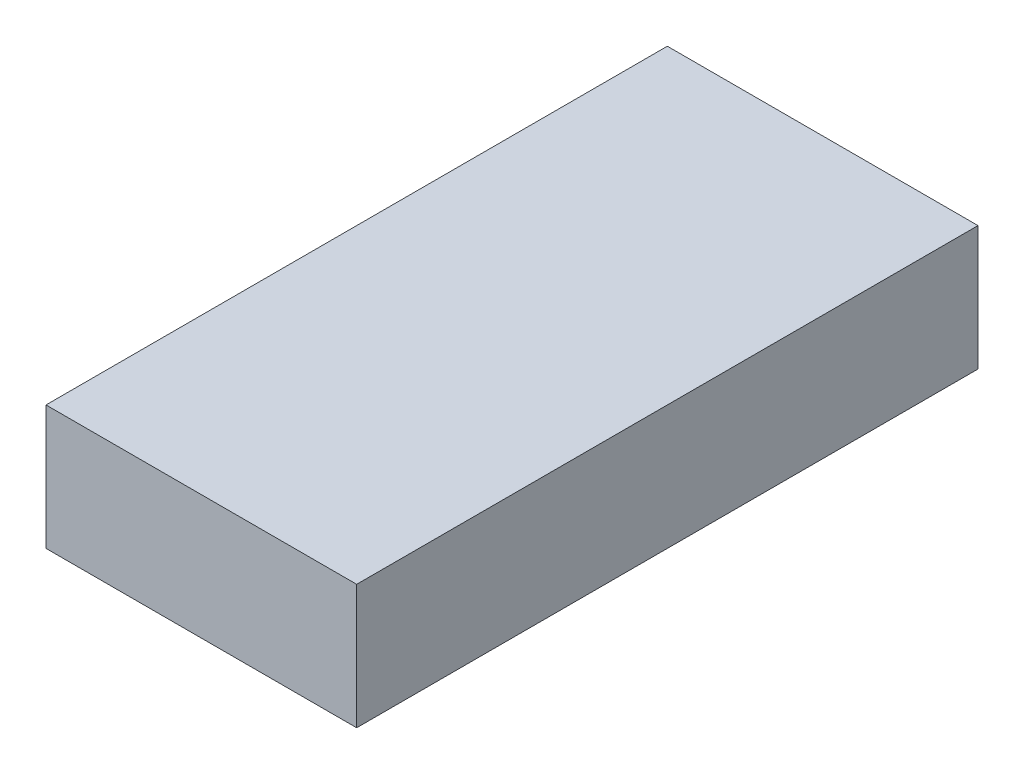
from build123d import *

# Parameters (mm, degrees)
SKETCH1_W           = 50
SKETCH1_H           = 100
BOSS_EXTRUDE1_DEPTH = 20


with BuildPart() as part:
    # Sketch1 → Boss-Extrude1 (new body)
    with BuildSketch(Plane(origin=(0, 0, 0), x_dir=(1, 0, 0), z_dir=(0, 1, 0))):
        Rectangle(SKETCH1_W, SKETCH1_H)
    extrude(amount=BOSS_EXTRUDE1_DEPTH)


solid = part.part
